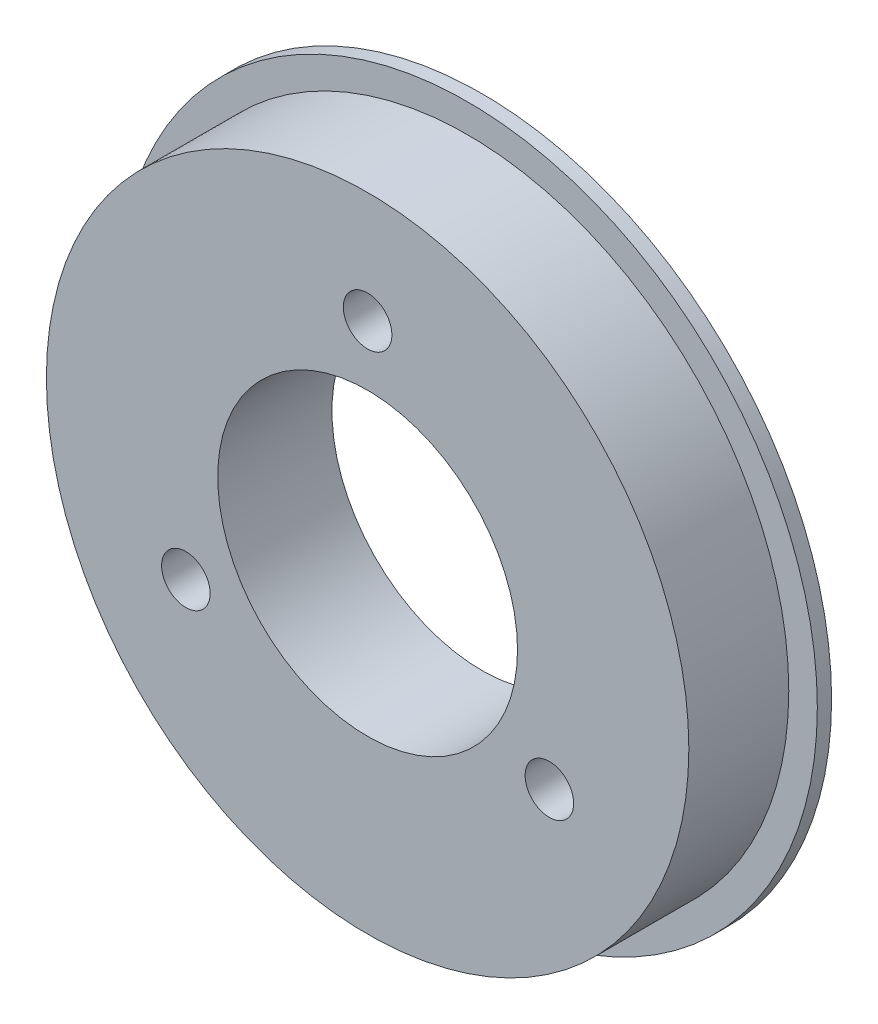
from build123d import *

# Parameters (mm, degrees)
SKETCH1_R           = 22.5
SKETCH1_R_2         = 1.7
SKETCH1_R_3         = 10.5
BOSS_EXTRUDE2_DEPTH = 7
BOSS_EXTRUDE3_START = -1
SKETCH1_3_R         = 24.5
SKETCH1_3_R_2       = 1.7
SKETCH1_3_R_3       = 10.5
BOSS_EXTRUDE3_DEPTH = 1


with BuildPart() as part:
    # Sketch1 → Boss-Extrude2 (new body)
    with BuildSketch(Plane.XY):
        Circle(SKETCH1_R)
        with Locations((-12.730573436, -7.35)):
            Circle(SKETCH1_R_2, mode=Mode.SUBTRACT)
        Circle(SKETCH1_R_3, mode=Mode.SUBTRACT)
        with Locations((12.730573436, -7.35)):
            Circle(SKETCH1_R_2, mode=Mode.SUBTRACT)
        with Locations((0, 14.7)):
            Circle(SKETCH1_R_2, mode=Mode.SUBTRACT)
    extrude(amount=BOSS_EXTRUDE2_DEPTH)

    # Sketch1<3> → Boss-Extrude3 (add)
    with BuildSketch(Plane.XY.offset(BOSS_EXTRUDE3_START)):
        Circle(SKETCH1_3_R)
        with Locations((-12.730573436, -7.35)):
            Circle(SKETCH1_3_R_2, mode=Mode.SUBTRACT)
        Circle(SKETCH1_3_R_3, mode=Mode.SUBTRACT)
        with Locations((12.730573436, -7.35)):
            Circle(SKETCH1_3_R_2, mode=Mode.SUBTRACT)
        with Locations((0, 14.7)):
            Circle(SKETCH1_3_R_2, mode=Mode.SUBTRACT)
    extrude(amount=BOSS_EXTRUDE3_DEPTH)


solid = part.part
